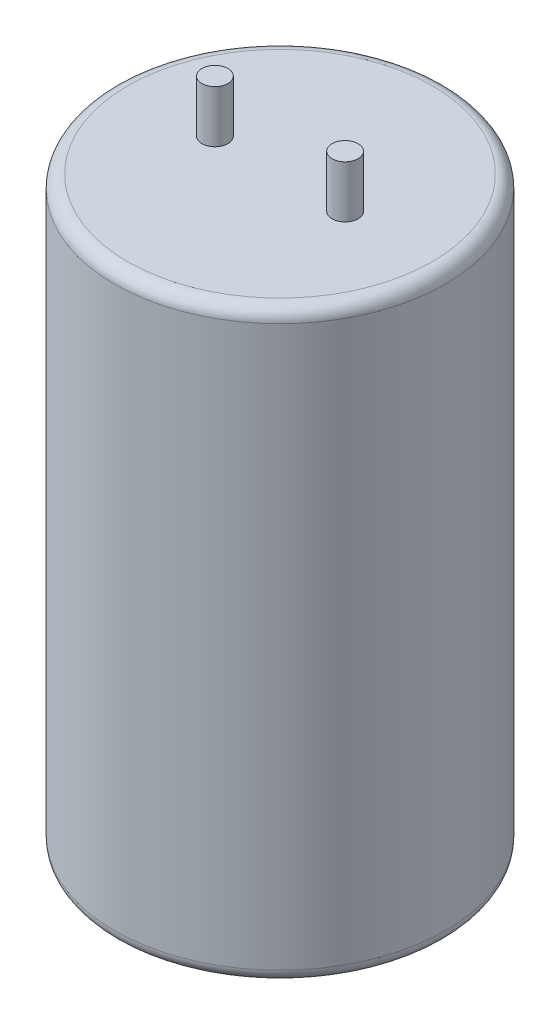
from build123d import *

# Parameters (mm, degrees)
ESBO_O1_R                = 12.7
RESSALTO_EXTRUS_O1_DEPTH = 45
FILETE1_R                = 1
ESBO_O2_R                = 1
RESSALTO_EXTRUS_O2_DEPTH = 4


with BuildPart() as part:
    # Esboço1 → Ressalto-extrusão1 (new body)
    with BuildSketch(Plane(origin=(0, 0, 0), x_dir=(1, 0, 0), z_dir=(0, 1, 0))):
        with Locations(Location((0, 0, 0), (0, 0, 90))):
            Circle(ESBO_O1_R)
    extrude(amount=RESSALTO_EXTRUS_O1_DEPTH)

    # Filete1
    filete1_edges = [part.edges().sort_by_distance(p)[0] for p in [
        (0, 0, 12.7),
        (0, 45, 12.7),
    ]]
    fillet(filete1_edges, radius=FILETE1_R)

    # Esboço2 → Ressalto-extrusão2 (add)
    with BuildSketch(Plane(origin=(0, 45, 0), x_dir=(1, 0, 0), z_dir=(0, 1, 0))):
        with Locations(Location((5, 0, 0), (0, 0, 270))):
            Circle(ESBO_O2_R)
        with Locations(Location((-5, 0, 0), (0, 0, 270))):
            Circle(ESBO_O2_R)
    extrude(amount=RESSALTO_EXTRUS_O2_DEPTH)


solid = part.part
